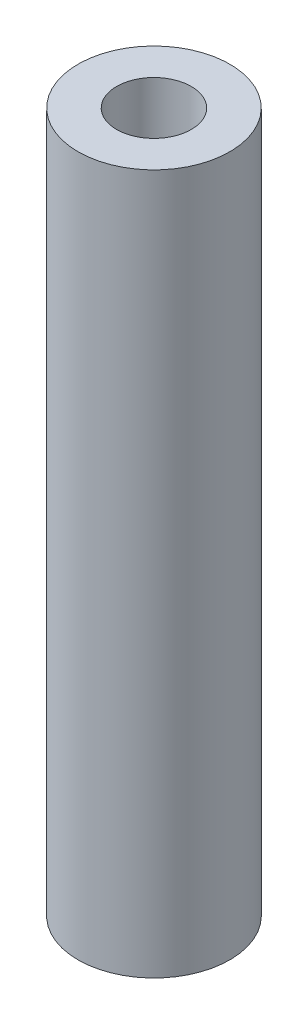
from build123d import *

# Parameters (mm, degrees)
SKETCH6_R           = 4.131274567
BOSS_EXTRUDE4_DEPTH = 38.1
SKETCH7_R           = 2.032
CUT_EXTRUDE2_DEPTH  = 38.1


with BuildPart() as part:
    # Sketch6 → Boss-Extrude4 (new body)
    with BuildSketch(Plane(origin=(0, 0, 0), x_dir=(1, 0, 0), z_dir=(0, 1, 0))):
        with Locations(Location((0, 0, 0), (0, 0, 270))):
            Circle(SKETCH6_R)
    extrude(amount=BOSS_EXTRUDE4_DEPTH)

    # Sketch7 → Cut-Extrude2 (cut)
    with BuildSketch(Plane(origin=(0, 38.1, 0), x_dir=(1, 0, 0), z_dir=(0, 1, 0))):
        with Locations(Location((0, 0, 0), (0, 0, 270))):
            Circle(SKETCH7_R)
    extrude(amount=-CUT_EXTRUDE2_DEPTH, mode=Mode.SUBTRACT)


solid = part.part
